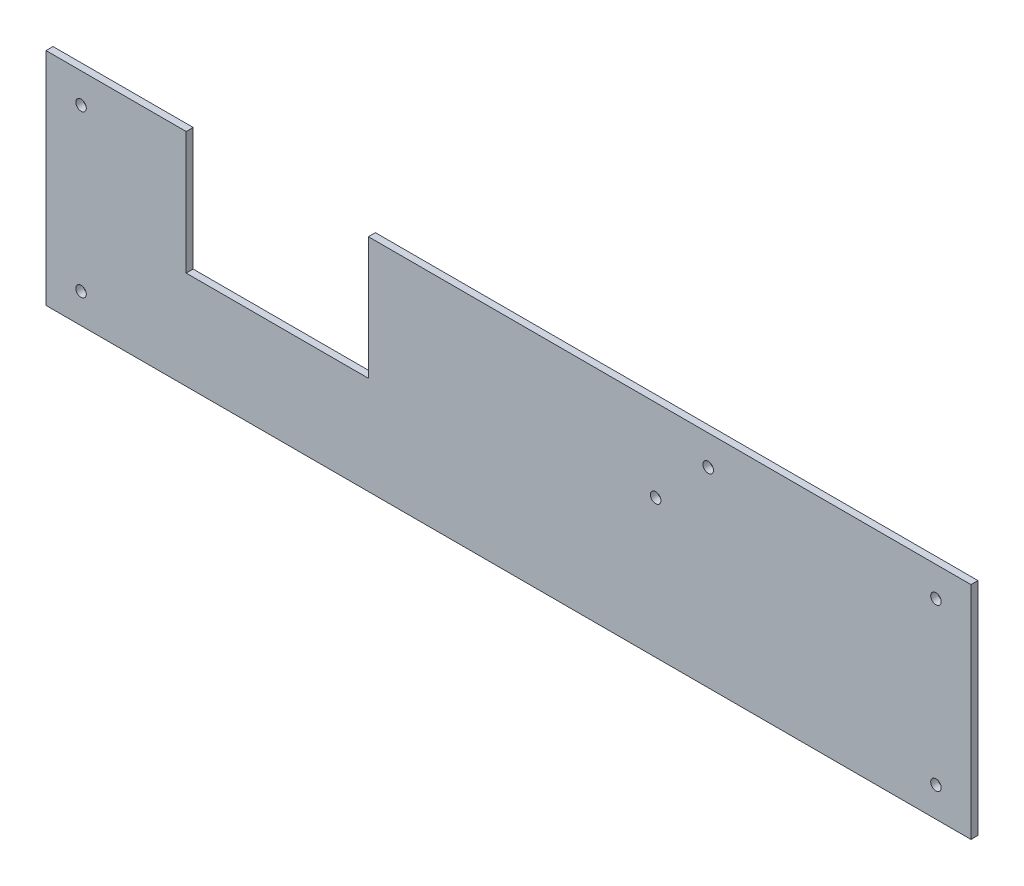
from build123d import *

# Parameters (mm, degrees)
ESQUISSE1_W      = 264
ESQUISSE1_H      = 63
ESQUISSE1_R      = 1.5
EXTRUSION1_DEPTH = 2
ESQUISSE2_R      = 1.5
EXTRUSION2_DEPTH = 10
ESQUISSE3_W      = 52
ESQUISSE3_H      = 35
EXTRUSION3_DEPTH = 10


with BuildPart() as part:
    # Esquisse1 → Extrusion1 (new body)
    with BuildSketch(Plane.XY):
        with Locations((86.261300687, 18.408191489)):
            Rectangle(ESQUISSE1_W, ESQUISSE1_H)
        with Locations((-35.738699313, 41.408191489)):
            Circle(ESQUISSE1_R, mode=Mode.SUBTRACT)
        with Locations((-35.738699313, -4.591808511)):
            Circle(ESQUISSE1_R, mode=Mode.SUBTRACT)
        with Locations((208.261300687, 41.408191489)):
            Circle(ESQUISSE1_R, mode=Mode.SUBTRACT)
        with Locations((208.261300687, -4.591808511)):
            Circle(ESQUISSE1_R, mode=Mode.SUBTRACT)
    extrude(amount=EXTRUSION1_DEPTH)

    # Esquisse2 → Extrusion2 (cut)
    with BuildSketch(Plane.XY.offset(2)):
        with Locations((143.261300687, 41.408191489)):
            Circle(ESQUISSE2_R)
        with Locations((128.261300687, 26.408191489)):
            Circle(ESQUISSE2_R)
    extrude(amount=-EXTRUSION2_DEPTH, mode=Mode.SUBTRACT)

    # Esquisse3 → Extrusion3 (cut)
    with BuildSketch(Plane.XY.offset(2)):
        with Locations((20.261300687, 32.408191489)):
            Rectangle(ESQUISSE3_W, ESQUISSE3_H)
    extrude(amount=-EXTRUSION3_DEPTH, mode=Mode.SUBTRACT)


solid = part.part
